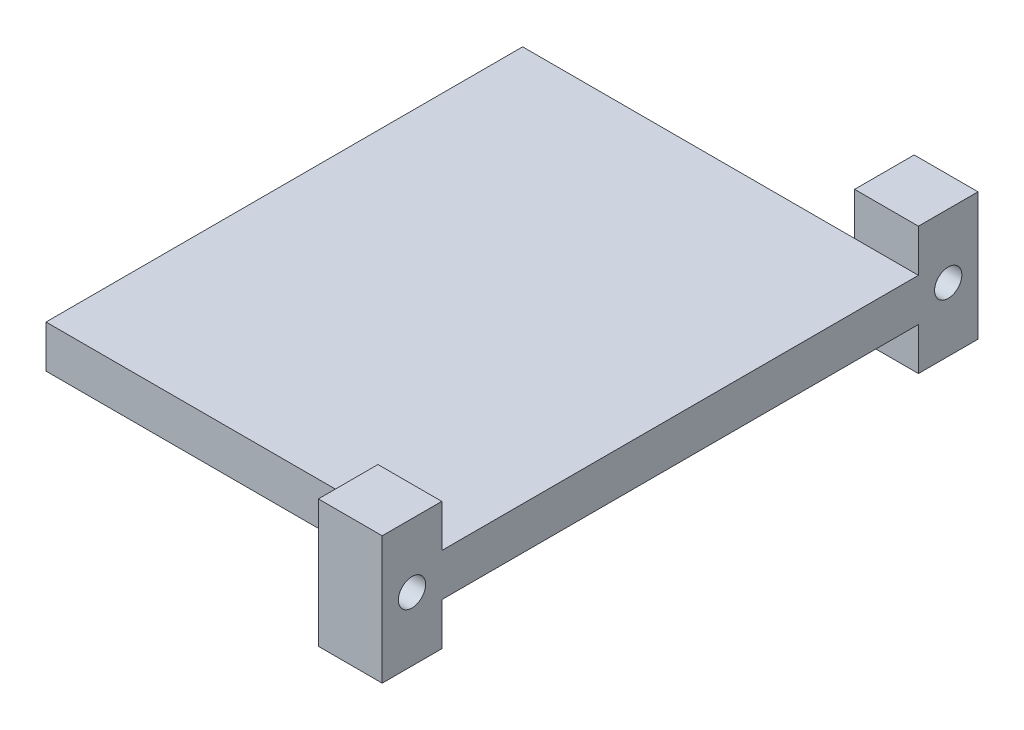
from build123d import *

# Parameters (mm, degrees)
SKETCH_1_W          = 100
SKETCH_1_H          = 100
EXTRUDE_1_DEPTH     = 5
SKETCH_2_W          = 30
SKETCH_2_H          = 5
CUT_EXTRUDE_1_DEPTH = 100
CUT_EXTRUDE_2_DEPTH = 5
SKETCH_4_W          = 39
SKETCH_4_H          = 7
CUT_EXTRUDE_3_DEPTH = 5
SKETCH_5_W          = 7.5
SKETCH_5_H          = 5
EXTRUDE_2_DEPTH     = 70
SKETCH_6_W          = 56
SKETCH_6_H          = 5
CUT_EXTRUDE_5_DEPTH = 7.5
SKETCH_7_W          = 7
SKETCH_7_H          = 5
EXTRUDE_3_DEPTH     = 7.5
CUT_EXTRUDE_6_DEPTH = 7.5


with BuildPart() as part:
    # 草图1 → 凸台-拉伸1 (new body)
    with BuildSketch(Plane(origin=(0, 0, 0), x_dir=(1, 0, 0), z_dir=(0, 1, 0))):
        with Locations((50, -50)):
            Rectangle(SKETCH_1_W, SKETCH_1_H)
    extrude(amount=EXTRUDE_1_DEPTH)

    # 草图2 → 切除-拉伸1 (cut)
    with BuildSketch(Plane.ZY):
        with Locations((15, 2.5)):
            Rectangle(SKETCH_2_W, SKETCH_2_H)
    extrude(amount=-CUT_EXTRUDE_1_DEPTH, mode=Mode.SUBTRACT)

    # 草图3 → 切除-拉伸2 (cut)
    with BuildSketch(Plane.XZ):
        Polygon((53.5, 43.5), (53.5, 30), (0, 30), (0, 100), (53.5, 100), align=None)
    extrude(amount=-CUT_EXTRUDE_2_DEPTH, mode=Mode.SUBTRACT)

    # 草图4 → 切除-拉伸3 (cut)
    with BuildSketch(Plane.XZ):
        with Locations((73, 33.5)):
            Rectangle(SKETCH_4_W, SKETCH_4_H)
        with Locations((73, 96.5)):
            Rectangle(SKETCH_4_W, SKETCH_4_H)
    extrude(amount=-CUT_EXTRUDE_3_DEPTH, mode=Mode.SUBTRACT)

    # 草图5 → 凸台-拉伸2 (add)
    with BuildSketch(Plane(origin=(0, 0, 30), x_dir=(-1, 0, 0), z_dir=(0, 0, -1))):
        with Locations((-96.25, 7.5)):
            Rectangle(SKETCH_5_W, SKETCH_5_H)
    extrude(amount=-EXTRUDE_2_DEPTH)

    # 草图6 → 切除-拉伸5 (cut)
    with BuildSketch(Plane.ZY.offset(-92.5)):
        with Locations((65, 7.5)):
            Rectangle(SKETCH_6_W, SKETCH_6_H)
    extrude(amount=-CUT_EXTRUDE_5_DEPTH, mode=Mode.SUBTRACT)

    # 草图7 → 凸台-拉伸3 (add)
    with BuildSketch(Plane.ZY.offset(-92.5)):
        with Locations((33.5, -2.5)):
            Rectangle(SKETCH_7_W, SKETCH_7_H)
        with Locations((96.5, -2.5)):
            Rectangle(SKETCH_7_W, SKETCH_7_H)
    extrude(amount=-EXTRUDE_3_DEPTH)

    # 草图8 → 切除-拉伸6 (cut)
    with BuildSketch(Plane.ZY.offset(-92.5)):
        with BuildLine():
            ThreePointArc((32.198026446, 3.42998111), (32.57001889, 1.198026446), (34.801973554, 1.57001889))
            Line((34.801973554, 1.57001889), (32.198026446, 3.42998111))
        make_face()
        with BuildLine():
            Line((32.198026446, 3.42998111), (34.801973554, 1.57001889))
            ThreePointArc((34.801973554, 1.57001889), (35.023672814, 2.01171611), (35.1, 2.5))
            ThreePointArc((35.1, 2.5), (33.98828389, 4.023672814), (32.198026446, 3.42998111))
        make_face()
        with BuildLine():
            ThreePointArc((98.1, 2.5), (96.98828389, 4.023672814), (95.198026446, 3.42998111))
            Line((95.198026446, 3.42998111), (97.801973554, 1.57001889))
            ThreePointArc((97.801973554, 1.57001889), (98.023672814, 2.01171611), (98.1, 2.5))
        make_face()
        with BuildLine():
            Line((97.801973554, 1.57001889), (95.198026446, 3.42998111))
            ThreePointArc((95.198026446, 3.42998111), (95.57001889, 1.198026446), (97.801973554, 1.57001889))
        make_face()
    extrude(amount=-CUT_EXTRUDE_6_DEPTH, mode=Mode.SUBTRACT)


solid = part.part
